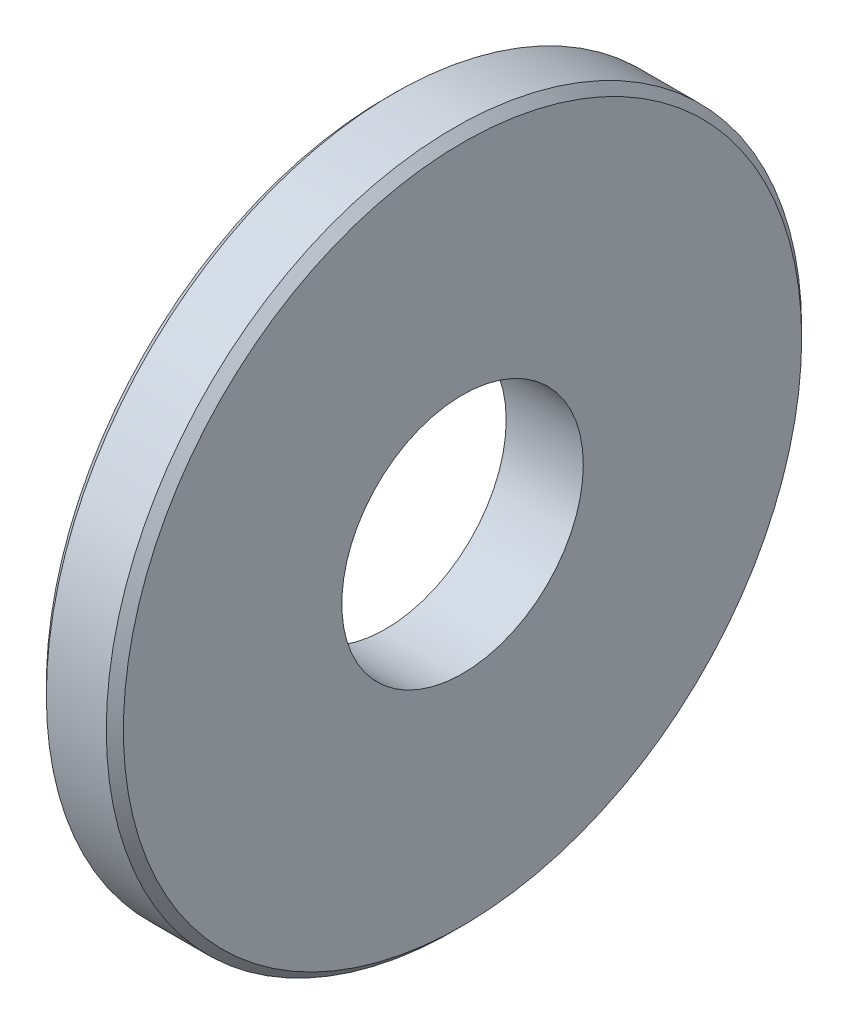
from build123d import *

# Parameters (mm, degrees)
SKETCH1_R           = 5.1562
SKETCH1_R_2         = 1.7907
BOSS_EXTRUDE1_DEPTH = 1.143
CHAMFER1_SIZE       = 0.127


with BuildPart() as part:
    # Sketch1 → Boss-Extrude1 (new body)
    with BuildSketch(Plane(origin=(0, 0, 0), x_dir=(0, 0, -1), z_dir=(1, 0, 0))):
        Circle(SKETCH1_R)
        Circle(SKETCH1_R_2, mode=Mode.SUBTRACT)
    extrude(amount=BOSS_EXTRUDE1_DEPTH)

    # Chamfer1
    chamfer1_edges = [part.edges().sort_by_distance(p)[0] for p in [
        (0, 0, 5.1562),
        (1.143, 0, 5.1562),
    ]]
    chamfer(chamfer1_edges, length=CHAMFER1_SIZE)


solid = part.part
